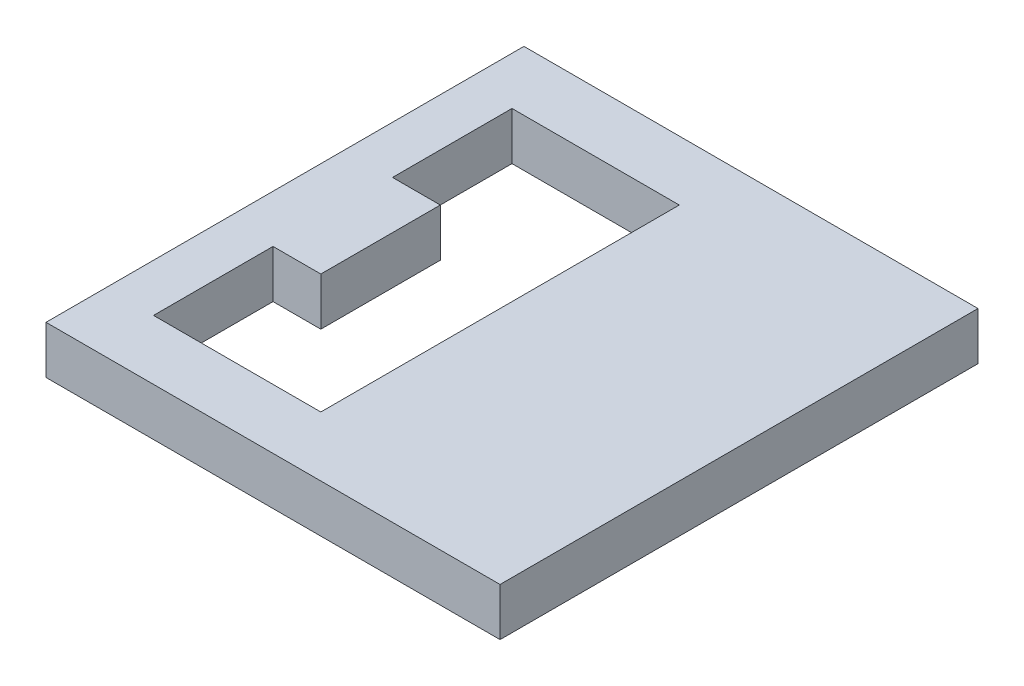
from build123d import *

# Parameters (mm, degrees)
SKETCH1_W           = 19
SKETCH1_H           = 20
SKETCH1_W_2         = 2
SKETCH1_H_2         = 5
BOSS_EXTRUDE1_DEPTH = 2
SKETCH2_W           = 5
SKETCH2_H           = 15
CUT_EXTRUDE1_DEPTH  = 10


with BuildPart() as part:
    # Sketch1 → Boss-Extrude1 (new body)
    with BuildSketch(Plane(origin=(0, 0, 0), x_dir=(1, 0, 0), z_dir=(0, 1, 0))):
        with Locations((5.5, 0)):
            Rectangle(SKETCH1_W, SKETCH1_H)
        with Locations((-1, 5)):
            Rectangle(SKETCH1_W_2, SKETCH1_H_2, mode=Mode.SUBTRACT)
        with Locations((-1, -5)):
            Rectangle(SKETCH1_W_2, SKETCH1_H_2, mode=Mode.SUBTRACT)
    extrude(amount=BOSS_EXTRUDE1_DEPTH)

    # Sketch2 → Cut-Extrude1 (cut)
    with BuildSketch(Plane(origin=(0, 2, 0), x_dir=(1, 0, 0), z_dir=(0, 1, 0))):
        with Locations((2.5, 0)):
            Rectangle(SKETCH2_W, SKETCH2_H)
    extrude(amount=-CUT_EXTRUDE1_DEPTH, mode=Mode.SUBTRACT)


solid = part.part
